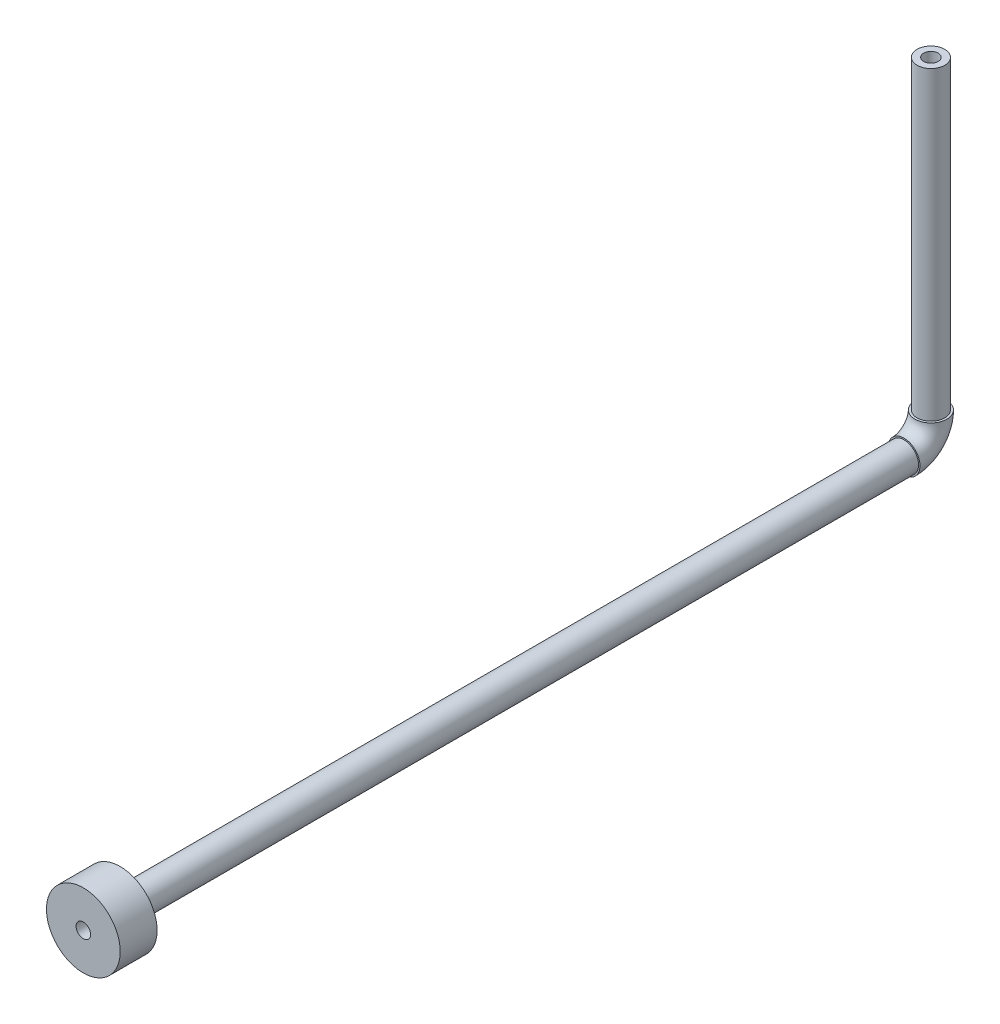
from build123d import *

# Parameters (mm, degrees)
SKETCH1_R           = 12.7
SKETCH1_R_2         = 5
BASE_EXTRUDE_DEPTH  = 12.7
SKETCH2_R           = 5
SKETCH2_R_2         = 2.5
BOSS_EXTRUDE1_DEPTH = 282.575
SKETCH5_R           = 5.5
SKETCH5_R_2         = 2.5
SKETCH7_R           = 4.7625
SKETCH7_R_2         = 2.5
BOSS_EXTRUDE2_DEPTH = 105.156


with BuildPart() as part:
    # Sketch1 → Base-Extrude (new body)
    with BuildSketch(Plane.XY):
        with Locations((563.692704422, 231.718004299)):
            Circle(SKETCH1_R)
        with Locations((563.692704422, 231.718004299)):
            Circle(SKETCH1_R_2, mode=Mode.SUBTRACT)
    extrude(amount=-BASE_EXTRUDE_DEPTH)

    # Sketch2 → Boss-Extrude1 (add)
    with BuildSketch(Plane.XY):
        with Locations((563.692704422, 231.718004299)):
            Circle(SKETCH2_R)
        with Locations((563.692704422, 231.718004299)):
            Circle(SKETCH2_R_2, mode=Mode.SUBTRACT)
    extrude(amount=-BOSS_EXTRUDE1_DEPTH)

    # Boss-Sweep2: sweep along a path in Sketch6
    with BuildLine(Plane(origin=(563.692704422, 0, 0), x_dir=(0, 0, -1), z_dir=(1, 0, 0))) as boss_sweep2_path:
        ThreePointArc((282.575, 231.718004299), (289.129269744, 234.432871718), (291.844137163, 240.987141462))
    # Sketch5 → Boss-Sweep2 (sweep)
    with BuildSketch(Plane(origin=(0, 0, -282.575), x_dir=(-1, 0, 0), z_dir=(0, 0, -1))):
        with Locations((-563.692704422, 231.718004299)):
            Circle(SKETCH5_R)
        with Locations((-563.692704422, 231.718004299)):
            Circle(SKETCH5_R_2, mode=Mode.SUBTRACT)
    sweep(path=boss_sweep2_path.line)

    # Sketch7 → Boss-Extrude2 (add)
    with BuildSketch(Plane(origin=(0, 240.987141462, 0), x_dir=(-1, 0, 0), z_dir=(0, 1, 0))):
        with Locations(Location((-563.692704422, -291.844137163, 0), (0, 0, 90))):
            Circle(SKETCH7_R)
        with Locations(Location((-563.692704422, -291.844137163, 0), (0, 0, 270))):
            Circle(SKETCH7_R_2, mode=Mode.SUBTRACT)
    extrude(amount=BOSS_EXTRUDE2_DEPTH)


solid = part.part
